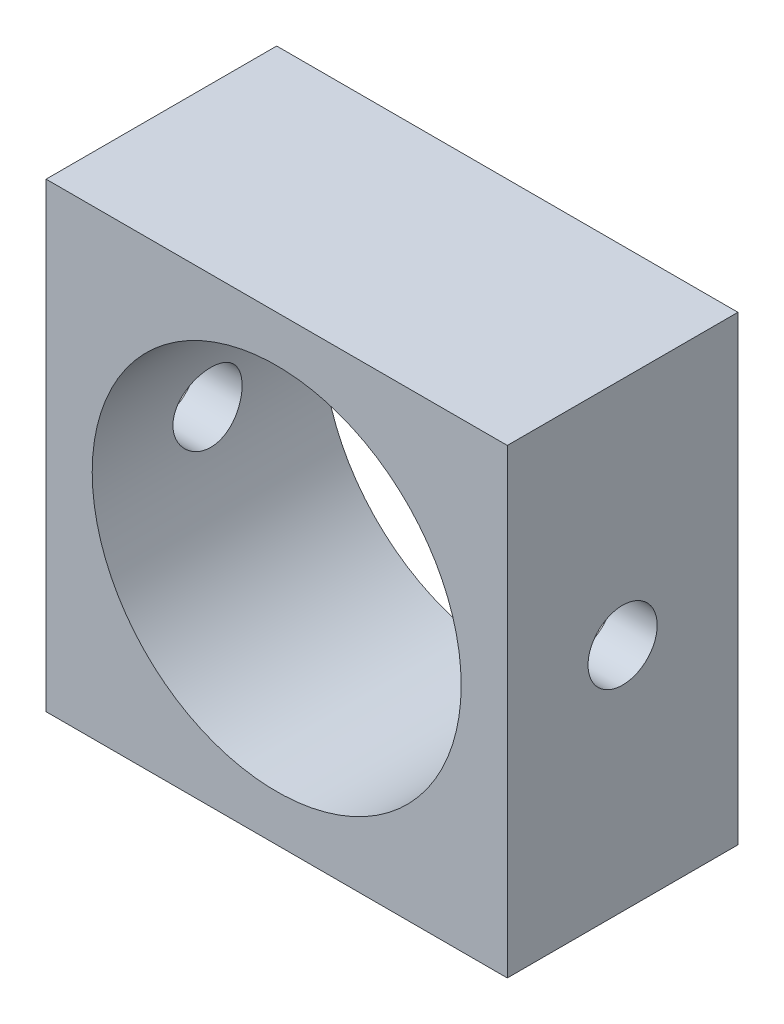
from build123d import *

# Parameters (mm, degrees)
SKETCH1_W           = 20
SKETCH1_H           = 20
SKETCH1_R           = 8
BOSS_EXTRUDE1_DEPTH = 10
SKETCH4_R           = 1.5
CUT_EXTRUDE1_DEPTH  = 20


with BuildPart() as part:
    # Sketch1 → Boss-Extrude1 (new body)
    with BuildSketch(Plane.XY):
        Rectangle(SKETCH1_W, SKETCH1_H)
        Circle(SKETCH1_R, mode=Mode.SUBTRACT)
    extrude(amount=BOSS_EXTRUDE1_DEPTH)

    # Sketch4 → Cut-Extrude1 (cut)
    with BuildSketch(Plane(origin=(10, 0, 0), x_dir=(0, 0, -1), z_dir=(1, 0, 0))):
        with Locations((-5, 0)):
            Circle(SKETCH4_R)
    extrude(amount=-CUT_EXTRUDE1_DEPTH, mode=Mode.SUBTRACT)


solid = part.part
